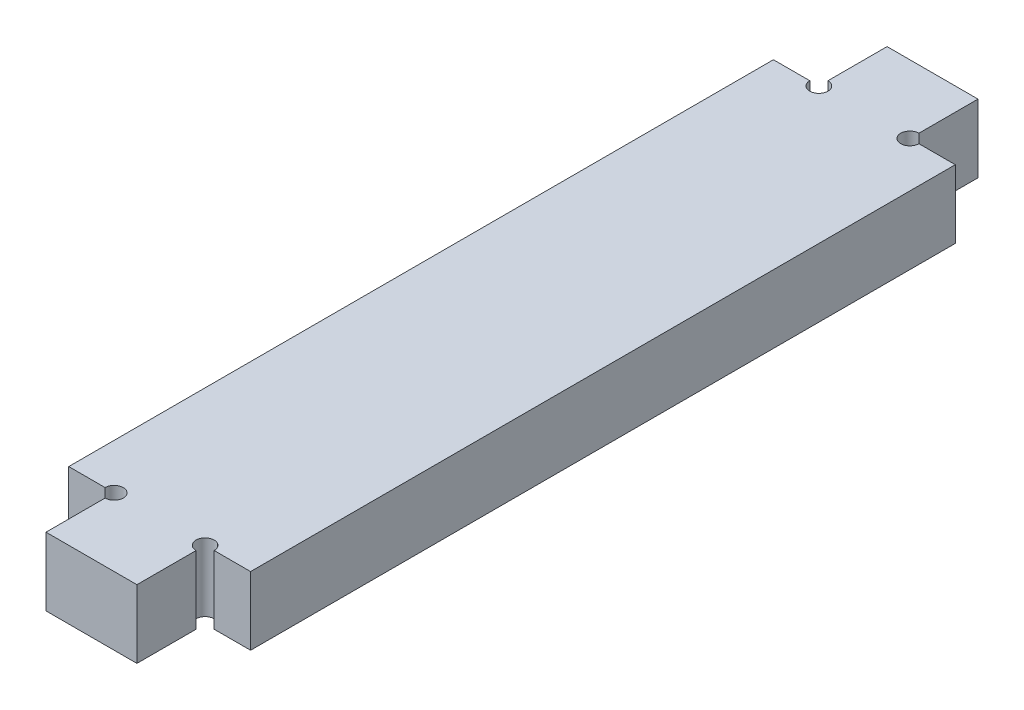
from build123d import *

# Parameters (mm, degrees)
BOSS_EXTRUDE2_DEPTH = 3
CUT_EXTRUDE5_DEPTH  = 3


with BuildPart() as part:
    # Sketch1 → Boss-Extrude2 (new body)
    with BuildSketch(Plane(origin=(0, 0, 0), x_dir=(1, 0, 0), z_dir=(0, 1, 0))):
        Polygon((4, 15.5), (4, -15.5), (2, -15.5), (2, -18.5), (-2, -18.5), (-2, -15.5), (-4, -15.5), (-4, 15.5), (-2, 15.5), (-2, 18.5), (2, 18.5), (2, 15.5), align=None)
    extrude(amount=BOSS_EXTRUDE2_DEPTH)

    # Sketch4 → Cut-Extrude5 (cut)
    with BuildSketch(Plane(origin=(0, 3, 0), x_dir=(1, 0, 0), z_dir=(0, 1, 0))):
        with BuildLine():
            Line((2, 15.9), (2, 15.5))
            Line((2, 15.5), (2.4, 15.5))
            ThreePointArc((2.4, 15.5), (1.717157288, 15.217157288), (2, 15.9))
        make_face()
        with BuildLine():
            Line((-2, 15.5), (-2.4, 15.5))
            ThreePointArc((-2.4, 15.5), (-1.717157288, 15.217157288), (-2, 15.9))
            Line((-2, 15.9), (-2, 15.5))
        make_face()
        with BuildLine():
            Line((-2, -15.9), (-2, -15.5))
            Line((-2, -15.5), (-2.4, -15.5))
            ThreePointArc((-2.4, -15.5), (-1.717157288, -15.217157288), (-2, -15.9))
        make_face()
        with BuildLine():
            Line((2, -15.5), (2.4, -15.5))
            ThreePointArc((2.4, -15.5), (1.717157288, -15.217157288), (2, -15.9))
            Line((2, -15.9), (2, -15.5))
        make_face()
    extrude(amount=-CUT_EXTRUDE5_DEPTH, mode=Mode.SUBTRACT)


solid = part.part
